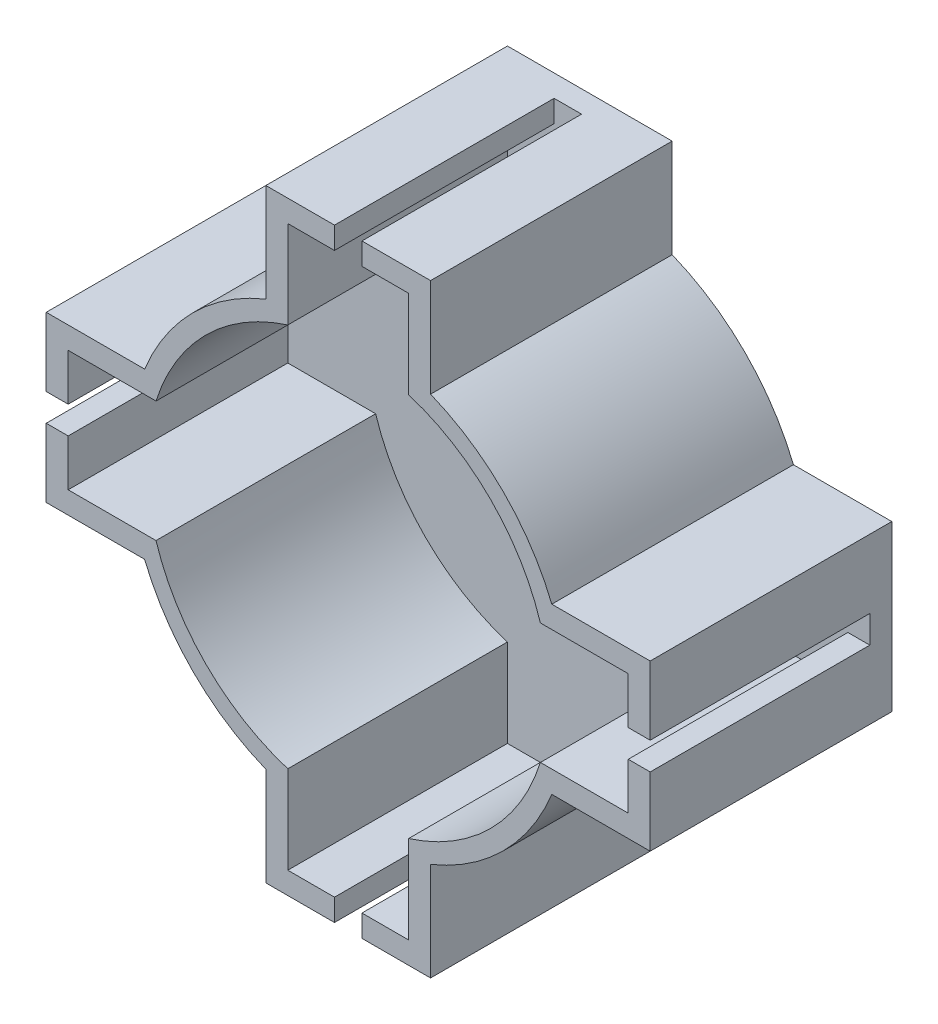
from build123d import *

# Parameters (mm, degrees)
SALIENTE_EXTRUIR1_DEPTH = 0.8
SALIENTE_EXTRUIR2_DEPTH = 8
CROQUIS3_R              = 2.25
CORTAR_EXTRUIR1_DEPTH   = 0.8


with BuildPart() as part:
    # Croquis1 → Saliente-Extruir1 (new body)
    with BuildSketch(Plane.XY):
        with BuildLine():
            Line((-68.221491284, 9.846072283), (-68.221491284, 13.429873796))
            Line((-68.221491284, 13.429873796), (-62.221491284, 13.429873796))
            Line((-62.221491284, 13.429873796), (-62.221491284, 9.846072283))
            ThreePointArc((-62.221491284, 9.846072283), (-59.564637034, 8.086728046), (-57.805292797, 5.429873796))
            Line((-57.805292797, 5.429873796), (-54.221491284, 5.429873796))
            Line((-54.221491284, 5.429873796), (-54.221491284, -0.570126204))
            Line((-54.221491284, -0.570126204), (-57.805292797, -0.570126204))
            ThreePointArc((-57.805292797, -0.570126204), (-59.564637034, -3.226980453), (-62.221491284, -4.986324691))
            Line((-62.221491284, -4.986324691), (-62.221491284, -8.570126204))
            Line((-62.221491284, -8.570126204), (-68.221491284, -8.570126204))
            Line((-68.221491284, -8.570126204), (-68.221491284, -4.986324691))
            ThreePointArc((-68.221491284, -4.986324691), (-70.878345533, -3.226980453), (-72.637689771, -0.570126204))
            Line((-72.637689771, -0.570126204), (-76.221491284, -0.570126204))
            Line((-76.221491284, -0.570126204), (-76.221491284, 5.429873796))
            Line((-76.221491284, 5.429873796), (-72.637689771, 5.429873796))
            ThreePointArc((-72.637689771, 5.429873796), (-70.878345533, 8.086728046), (-68.221491284, 9.846072283))
        make_face()
    extrude(amount=SALIENTE_EXTRUIR1_DEPTH)

    # Croquis2 → Saliente-Extruir2 (add)
    with BuildSketch(Plane.XY.offset(0.8)):
        with BuildLine():
            Line((-72.637689771, -0.570126204), (-76.221491284, -0.570126204))
            Line((-76.221491284, -0.570126204), (-76.221491284, 1.929873796))
            Line((-76.221491284, 1.929873796), (-75.421491284, 1.929873796))
            Line((-75.421491284, 1.929873796), (-75.421491284, 0.229873796))
            Line((-75.421491284, 0.229873796), (-72.221491284, 0.229873796))
            ThreePointArc((-72.221491284, 0.229873796), (-70.409939992, -2.758574912), (-67.421491284, -4.570126204))
            Line((-67.421491284, -4.570126204), (-67.421491284, -7.770126204))
            Line((-67.421491284, -7.770126204), (-65.721491284, -7.770126204))
            Line((-65.721491284, -7.770126204), (-65.721491284, -8.570126204))
            Line((-65.721491284, -8.570126204), (-68.221491284, -8.570126204))
            Line((-68.221491284, -8.570126204), (-68.221491284, -4.986324691))
            ThreePointArc((-68.221491284, -4.986324691), (-70.878345533, -3.226980453), (-72.637689771, -0.570126204))
        make_face()
        with BuildLine():
            Line((-76.221491284, 5.429873796), (-72.637689771, 5.429873796))
            ThreePointArc((-72.637689771, 5.429873796), (-70.878345533, 8.086728046), (-68.221491284, 9.846072283))
            Line((-68.221491284, 9.846072283), (-68.221491284, 13.429873796))
            Line((-68.221491284, 13.429873796), (-65.721491284, 13.429873796))
            Line((-65.721491284, 13.429873796), (-65.721491284, 12.629873796))
            Line((-65.721491284, 12.629873796), (-67.421491284, 12.629873796))
            Line((-67.421491284, 12.629873796), (-67.421491284, 9.429873796))
            ThreePointArc((-67.421491284, 9.429873796), (-70.409939992, 7.618322504), (-72.221491284, 4.629873796))
            Line((-72.221491284, 4.629873796), (-75.421491284, 4.629873796))
            Line((-75.421491284, 4.629873796), (-75.421491284, 2.929873796))
            Line((-75.421491284, 2.929873796), (-76.221491284, 2.929873796))
            Line((-76.221491284, 2.929873796), (-76.221491284, 5.429873796))
        make_face()
        with BuildLine():
            Line((-62.221491284, 13.429873796), (-62.221491284, 9.846072283))
            ThreePointArc((-62.221491284, 9.846072283), (-59.564637034, 8.086728046), (-57.805292797, 5.429873796))
            Line((-57.805292797, 5.429873796), (-54.221491284, 5.429873796))
            Line((-54.221491284, 5.429873796), (-54.221491284, 2.929873796))
            Line((-54.221491284, 2.929873796), (-55.021491284, 2.929873796))
            Line((-55.021491284, 2.929873796), (-55.021491284, 4.629873796))
            Line((-55.021491284, 4.629873796), (-58.221491284, 4.629873796))
            ThreePointArc((-58.221491284, 4.629873796), (-60.033042575, 7.618322504), (-63.021491284, 9.429873796))
            Line((-63.021491284, 9.429873796), (-63.021491284, 12.629873796))
            Line((-63.021491284, 12.629873796), (-64.721491284, 12.629873796))
            Line((-64.721491284, 12.629873796), (-64.721491284, 13.429873796))
            Line((-64.721491284, 13.429873796), (-62.221491284, 13.429873796))
        make_face()
        with BuildLine():
            Line((-54.221491284, -0.570126204), (-57.805292797, -0.570126204))
            ThreePointArc((-57.805292797, -0.570126204), (-59.564637034, -3.226980453), (-62.221491284, -4.986324691))
            Line((-62.221491284, -4.986324691), (-62.221491284, -8.570126204))
            Line((-62.221491284, -8.570126204), (-64.721491284, -8.570126204))
            Line((-64.721491284, -8.570126204), (-64.721491284, -7.770126204))
            Line((-64.721491284, -7.770126204), (-63.021491284, -7.770126204))
            Line((-63.021491284, -7.770126204), (-63.021491284, -4.570126204))
            ThreePointArc((-63.021491284, -4.570126204), (-60.033042575, -2.758574912), (-58.221491284, 0.229873796))
            Line((-58.221491284, 0.229873796), (-55.021491284, 0.229873796))
            Line((-55.021491284, 0.229873796), (-55.021491284, 1.929873796))
            Line((-55.021491284, 1.929873796), (-54.221491284, 1.929873796))
            Line((-54.221491284, 1.929873796), (-54.221491284, -0.570126204))
        make_face()
    extrude(amount=SALIENTE_EXTRUIR2_DEPTH)

    # Croquis3 → Cortar-Extruir1 (cut)
    with BuildSketch(Plane.XY.offset(0.8)):
        with Locations((-65.221491284, 2.429873796)):
            Circle(CROQUIS3_R)
    extrude(amount=-CORTAR_EXTRUIR1_DEPTH, mode=Mode.SUBTRACT)


solid = part.part
